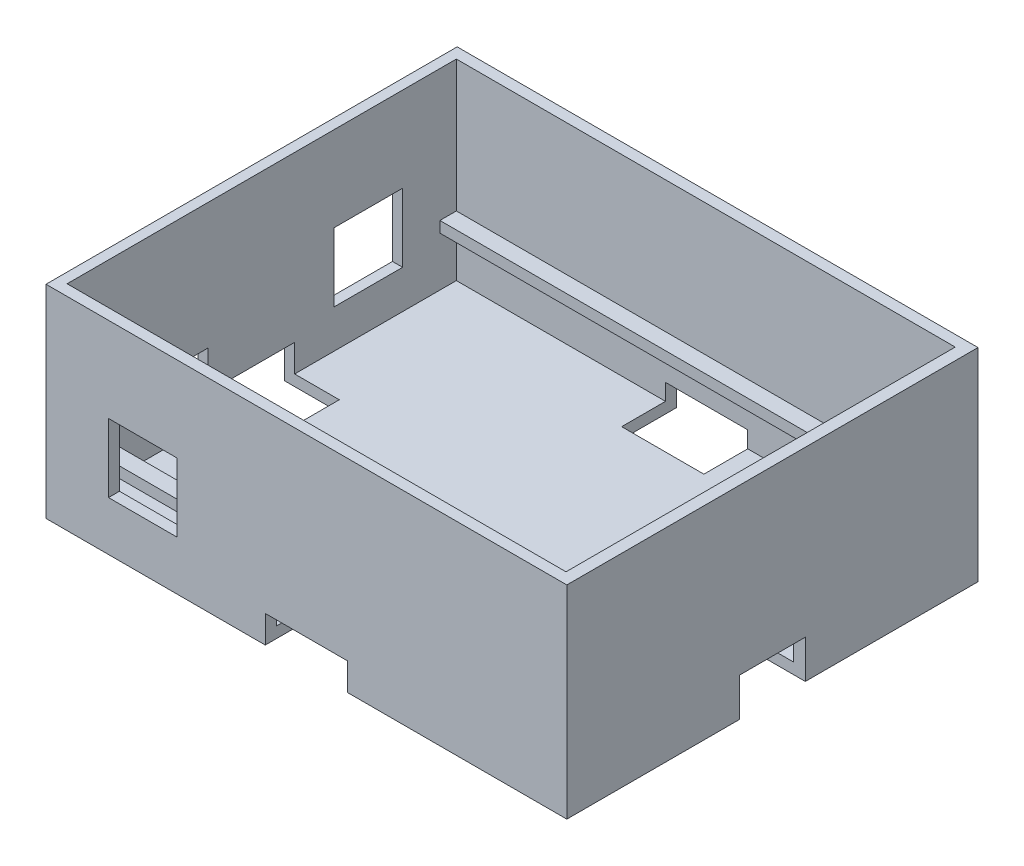
from build123d import *

# Parameters (mm, degrees)
SKETCH1_W           = 95
SKETCH1_H           = 75
BOSS_EXTRUDE1_DEPTH = 2
SKETCH2_W           = 95
SKETCH2_H           = 75
SKETCH2_W_2         = 91
SKETCH2_H_2         = 71
BOSS_EXTRUDE2_DEPTH = 35
SKETCH3_W           = 12.5
SKETCH3_H           = 12.5
CUT_EXTRUDE1_DEPTH  = 10
SKETCH4_W           = 12.5
SKETCH4_H           = 12.5
CUT_EXTRUDE2_DEPTH  = 10
SKETCH5_W           = 9.5
SKETCH5_H           = 5
CUT_EXTRUDE3_DEPTH  = 10
SKETCH6_W           = 15
SKETCH6_H           = 5
CUT_EXTRUDE4_DEPTH  = 10
SKETCH7_W           = 12
SKETCH7_H           = 7
CUT_EXTRUDE5_DEPTH  = 10
SKETCH8_W           = 91
SKETCH8_H           = 2
BOSS_EXTRUDE3_DEPTH = 3


with BuildPart() as part:
    # Sketch1 → Boss-Extrude1 (new body)
    with BuildSketch(Plane(origin=(0, 0, 0), x_dir=(1, 0, 0), z_dir=(0, 1, 0))):
        Rectangle(SKETCH1_W, SKETCH1_H)
    extrude(amount=BOSS_EXTRUDE1_DEPTH)

    # Sketch2 → Boss-Extrude2 (add)
    with BuildSketch(Plane(origin=(0, 2, 0), x_dir=(1, 0, 0), z_dir=(0, 1, 0))):
        Rectangle(SKETCH2_W, SKETCH2_H)
        with Locations((-0.148465207, 0)):
            Rectangle(SKETCH2_W_2, SKETCH2_H_2, mode=Mode.SUBTRACT)
    extrude(amount=BOSS_EXTRUDE2_DEPTH)

    # Sketch3 → Cut-Extrude1 (cut)
    with BuildSketch(Plane.XY.offset(37.5)):
        with Locations((-29.85, 15.25)):
            Rectangle(SKETCH3_W, SKETCH3_H)
    extrude(amount=-CUT_EXTRUDE1_DEPTH, mode=Mode.SUBTRACT)

    # Sketch4 → Cut-Extrude2 (cut)
    with BuildSketch(Plane.ZY.offset(47.5)):
        with Locations((-19.45, 15.25)):
            Rectangle(SKETCH4_W, SKETCH4_H)
    extrude(amount=-CUT_EXTRUDE2_DEPTH, mode=Mode.SUBTRACT)

    # Sketch5 → Cut-Extrude3 (cut)
    with BuildSketch(Plane.ZY.offset(47.5)):
        with Locations((14.55, 11.5)):
            Rectangle(SKETCH5_W, SKETCH5_H)
    extrude(amount=-CUT_EXTRUDE3_DEPTH, mode=Mode.SUBTRACT)

    # Sketch6 → Cut-Extrude4 (cut)
    with BuildSketch(Plane(origin=(0, 0, -37.5), x_dir=(-1, 0, 0), z_dir=(0, 0, -1))):
        with Locations((0, 2.5)):
            Rectangle(SKETCH6_W, SKETCH6_H)
    cut_extrude4 = extrude(amount=-CUT_EXTRUDE4_DEPTH, mode=Mode.SUBTRACT)

    # Mirror1: Cut-Extrude4 across plane
    add(cut_extrude4.mirror(Plane.XY), mode=Mode.SUBTRACT)

    # Sketch7 → Cut-Extrude5 (cut)
    with BuildSketch(Plane.ZY.offset(47.5)):
        with Locations((0, 3.5)):
            Rectangle(SKETCH7_W, SKETCH7_H)
    cut_extrude5 = extrude(amount=-CUT_EXTRUDE5_DEPTH, mode=Mode.SUBTRACT)

    # Mirror2: Cut-Extrude5 across plane
    add(cut_extrude5.mirror(Plane(origin=(0, 0, 0), x_dir=(0, 0, 1), z_dir=(1, 0, 0))), mode=Mode.SUBTRACT)

    # Sketch8 → Boss-Extrude3 (add)
    with BuildSketch(Plane.XY.offset(-35.5)):
        with Locations((-0.148465207, 12)):
            Rectangle(SKETCH8_W, SKETCH8_H)
    boss_extrude3 = extrude(amount=BOSS_EXTRUDE3_DEPTH)

    # Mirror3: Boss-Extrude3 across plane
    add(boss_extrude3.mirror(Plane.XY))


solid = part.part
